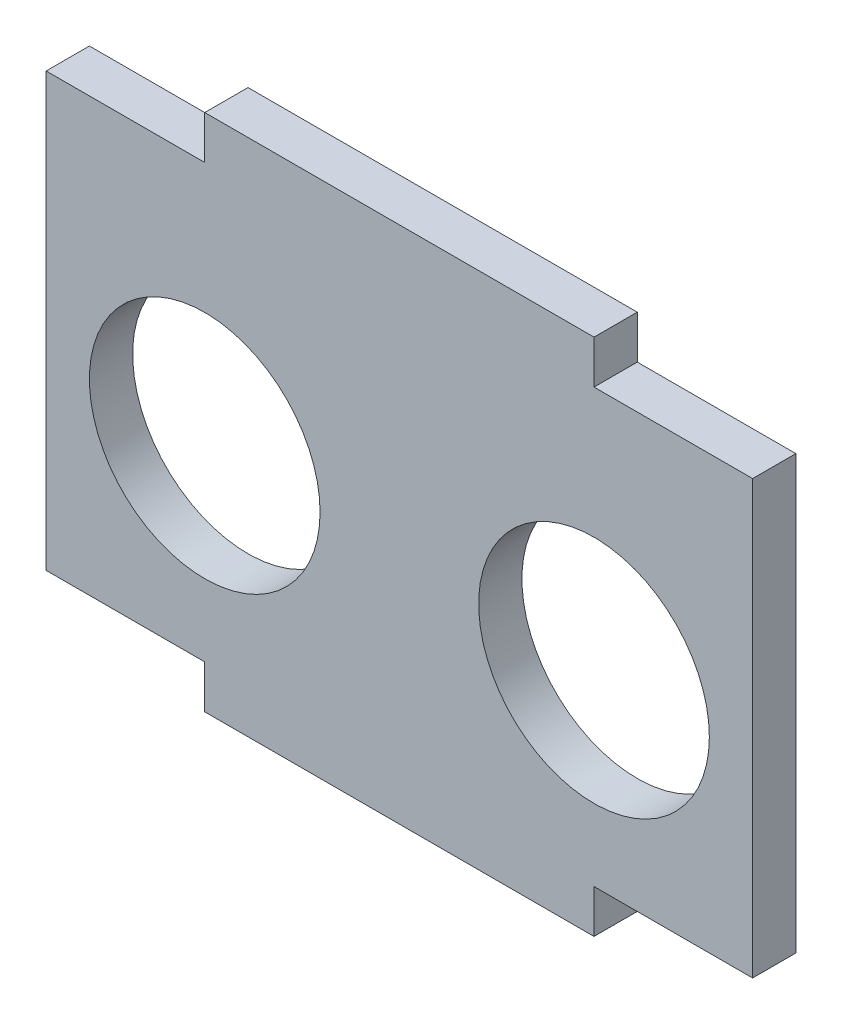
from build123d import *

# Parameters (mm, degrees)
MODEL_R             = 8
BOSS_EXTRUDE1_DEPTH = 3


with BuildPart() as part:
    # Model → Boss-Extrude1 (new body)
    with BuildSketch(Plane.XY):
        Polygon((11.949818483, 0.880696589), (11.949818483, 30.880698285), (22.949818483, 30.884397455), (22.949818483, 33.884397625), (49.949818483, 33.893477406), (49.949818483, 30.893477236), (60.949818483, 30.897176406), (60.949818483, 0.89717471), (49.949818483, 0.89347554), (49.949818483, -2.10652463), (22.949818483, -2.115604411), (22.949818483, 0.884395759), align=None)
        with Locations((22.949818483, 13.879651404)):
            Circle(MODEL_R, mode=Mode.SUBTRACT)
        with Locations((49.949818483, 13.879651404)):
            Circle(MODEL_R, mode=Mode.SUBTRACT)
    extrude(amount=BOSS_EXTRUDE1_DEPTH)


solid = part.part
